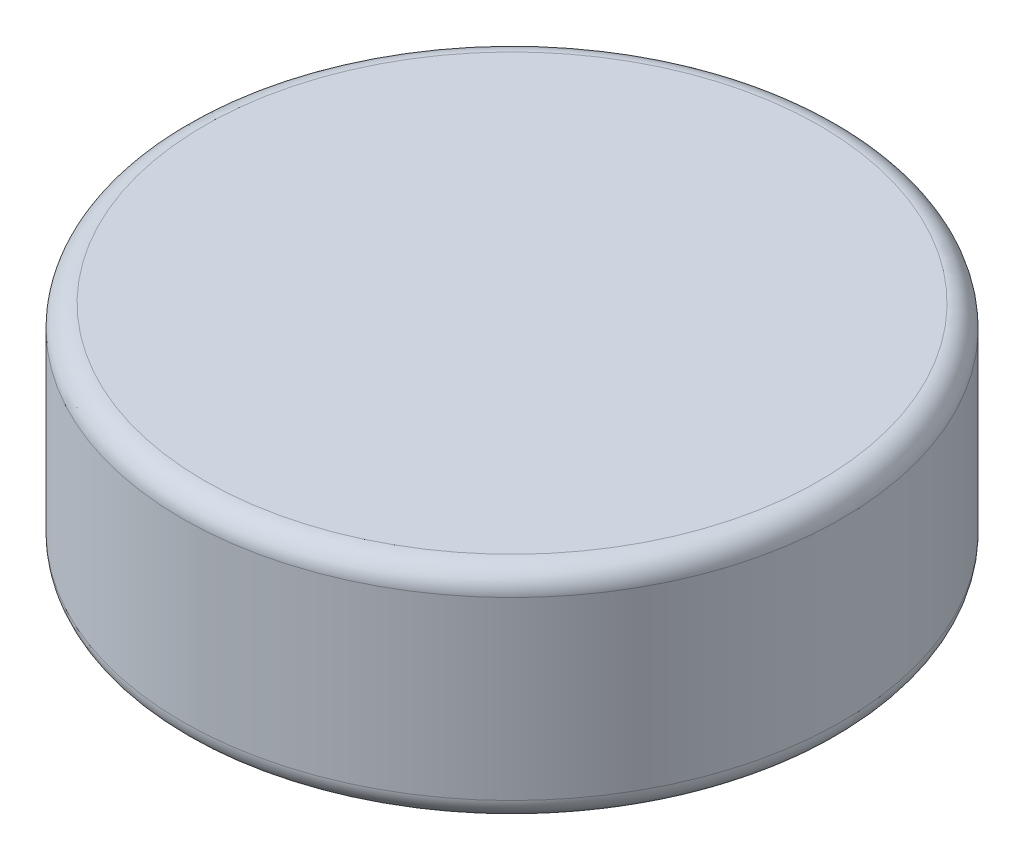
from build123d import *

# Parameters (mm, degrees)
SKETCH1_R           = 38.1
BOSS_EXTRUDE1_DEPTH = 25.4
FILLET1_R           = 2.54


with BuildPart() as part:
    # Sketch1 → Boss-Extrude1 (new body)
    with BuildSketch(Plane(origin=(0, 0, 0), x_dir=(1, 0, 0), z_dir=(0, 1, 0))):
        with Locations(Location((0, 0, 0), (0, 0, 270))):
            Circle(SKETCH1_R)
    extrude(amount=BOSS_EXTRUDE1_DEPTH)

    # Fillet1
    fillet1_edges = [part.edges().sort_by_distance(p)[0] for p in [
        (0, 0, -38.1),
        (0, 25.4, -38.1),
    ]]
    fillet(fillet1_edges, radius=FILLET1_R)


solid = part.part
